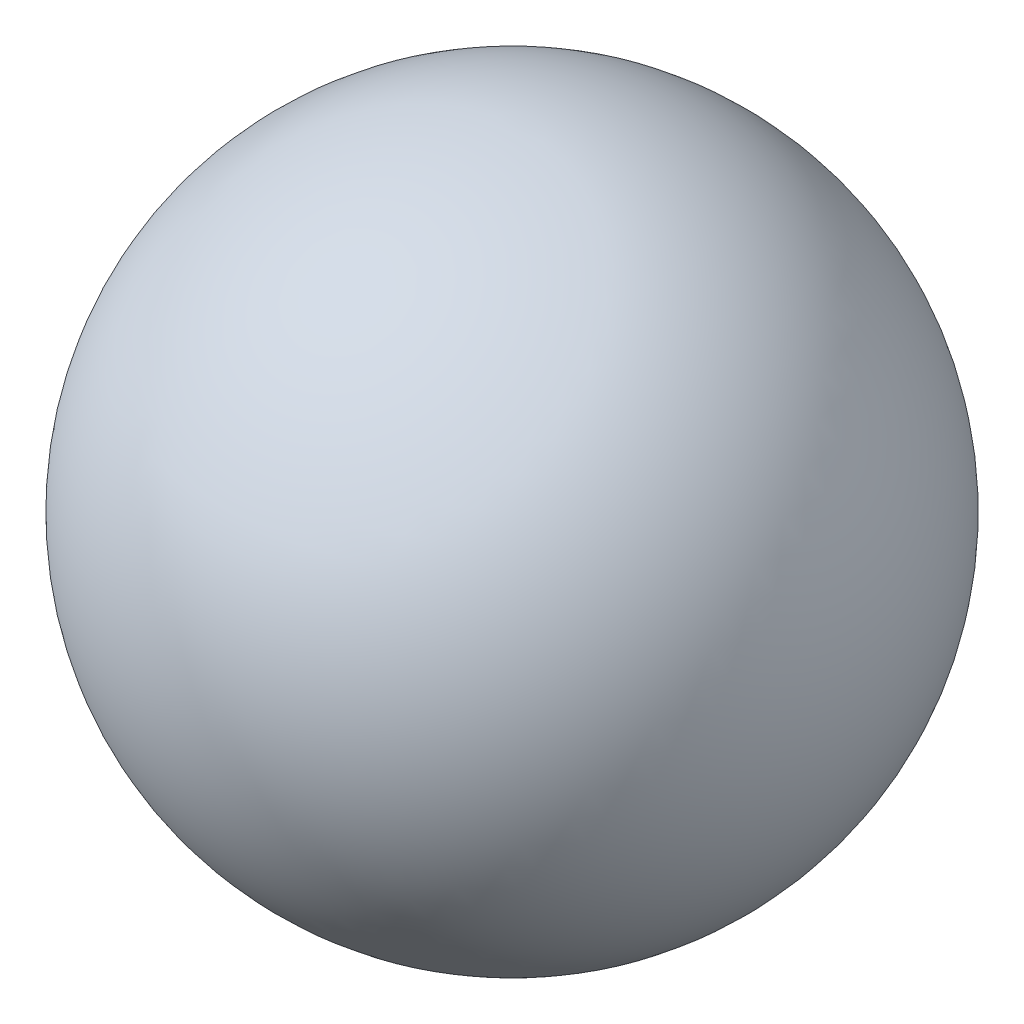
from build123d import *


with BuildPart() as part:
    # Sketch1 → Revolve1 (revolve)
    with BuildSketch(Plane.XY):
        with BuildLine():
            Line((0, 11.303), (0, -11.303))
            ThreePointArc((0, -11.303), (-11.303, 0), (0, 11.303))
        make_face()
    revolve(axis=Axis((0, 11.303, 0), (0, -1, 0)))


solid = part.part
